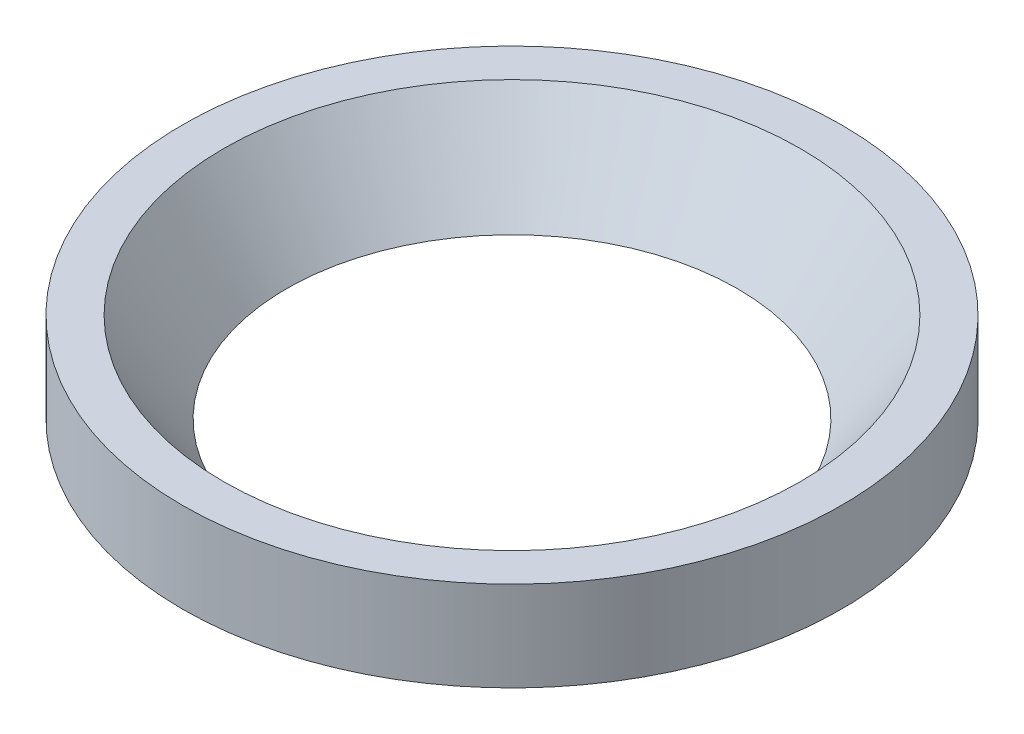
from build123d import *


with BuildPart() as part:
    # Sketch1 → Revolve1 (revolve)
    with BuildSketch(Plane.XY, mode=Mode.PRIVATE) as revolve1_sk:
        Polygon((-53.469872334, 39.7879841), (-47.798846397, 39.7879841), (-61.1378, 58.8379841), (-69.85, 58.8379841), (-69.85, 39.7879841), (-63.1204351, 39.7879841), align=None)
    revolve(revolve1_sk.sketch.rotate(Axis((0, -117.749222998, 0), (0, 1, 0)), 270), axis=Axis((0, -117.749222998, 0), (0, 1, 0)))


solid = part.part
